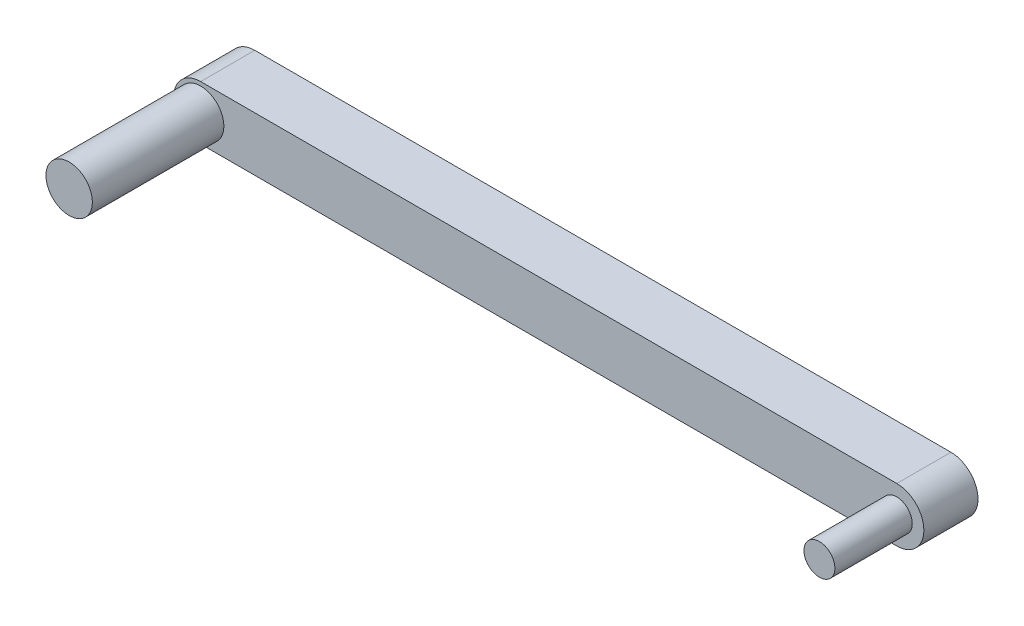
from build123d import *

# Parameters (mm, degrees)
BOSS_EXTRUDE1_DEPTH = 3.5
SKETCH2_R           = 1.5
BOSS_EXTRUDE2_DEPTH = 8.5
SKETCH3_R           = 1
BOSS_EXTRUDE3_DEPTH = 5


with BuildPart() as part:
    # Sketch1 → Boss-Extrude1 (new body)
    with BuildSketch(Plane.XY):
        with BuildLine():
            Line((-44.435656646, 8.394675461), (0.564343354, 8.394675461))
            ThreePointArc((0.564343354, 8.394675461), (2.314343354, 10.144675461), (0.564343354, 11.894675461))
            Line((0.564343354, 11.894675461), (-44.435656646, 11.894675461))
            ThreePointArc((-44.435656646, 11.894675461), (-46.185656646, 10.144675461), (-44.435656646, 8.394675461))
        make_face()
    extrude(amount=BOSS_EXTRUDE1_DEPTH)

    # Sketch2 → Boss-Extrude2 (add)
    with BuildSketch(Plane.XY.offset(3.5)):
        with Locations((-44.435656646, 10.144675461)):
            Circle(SKETCH2_R)
    extrude(amount=BOSS_EXTRUDE2_DEPTH)

    # Sketch3 → Boss-Extrude3 (add)
    with BuildSketch(Plane.XY.offset(3.5)):
        with Locations((0.564343354, 10.144675461)):
            Circle(SKETCH3_R)
    extrude(amount=BOSS_EXTRUDE3_DEPTH)


solid = part.part
